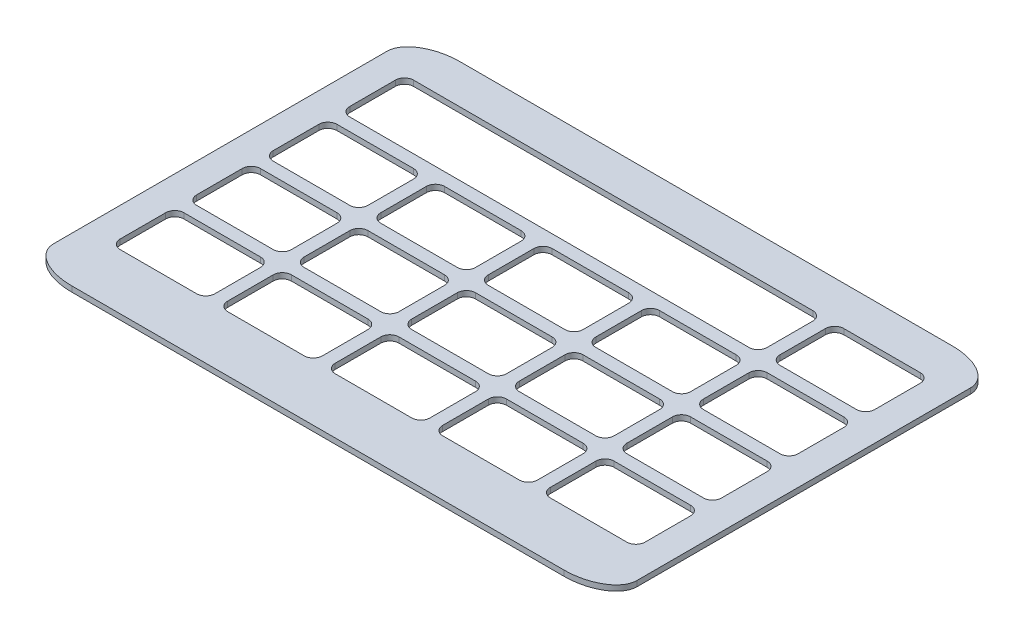
from build123d import *

# Parameters (mm, degrees)
SKETCH1_W                 = 320
SKETCH1_H                 = 213
OUTER_PROFILE_DEPTH       = 3
SKETCH5_W                 = 52
SKETCH5_H                 = 35
CUTOUT_DEPTH              = 193.227079258
CORNER_RAD_R              = 5
LPATTERN1_COUNT           = 5
LPATTERN1_PITCH           = 59
LPATTERN1_COUNT_DIR2      = 4
LPATTERN1_PITCH_DIR2      = 42
CORNER_RAD_OF_LPATTERN1_R = 5
CORNER_DEPTH              = 193.227079258
CORNERSB_COPY_1_DEPTH     = 193.227079258
SKETCH7_W                 = 135
SKETCH7_H                 = 35
CUT_EXTRUDE2_DEPTH        = 193.227079398


with BuildPart() as part:
    # Sketch1 → Outer Profile (new body)
    with BuildSketch(Plane(origin=(0, 0, 0), x_dir=(1, 0, 0), z_dir=(0, 1, 0))):
        Rectangle(SKETCH1_W, SKETCH1_H)
    extrude(amount=OUTER_PROFILE_DEPTH)

    # Sketch5 → Cutout (cut, through all)
    with BuildSketch(Plane(origin=(0, 3, 0), x_dir=(1, 0, 0), z_dir=(0, 1, 0))):
        with Locations((-118, -58.5)):
            Rectangle(SKETCH5_W, SKETCH5_H)
    cutout = extrude(amount=-CUTOUT_DEPTH, mode=Mode.SUBTRACT)

    # Corner Rad
    corner_rad_edges = [part.edges().sort_by_distance(p)[0] for p in [
        (-144, 1.5, 76),
        (-144, 1.5, 41),
        (-92, 1.5, 41),
        (-92, 1.5, 76),
    ]]
    fillet(corner_rad_edges, radius=CORNER_RAD_R)

    # LPattern1: Cutout 5 × 4
    with Locations(*[(i * LPATTERN1_PITCH, 0, -j * LPATTERN1_PITCH_DIR2) for i in range(LPATTERN1_COUNT) for j in range(LPATTERN1_COUNT_DIR2) if (i, j) != (0, 0)]):
        add(cutout, mode=Mode.SUBTRACT)

    # Corner Rad of LPattern1
    corner_rad_of_lpattern1_edges = [part.edges().sort_by_distance(p)[0] for p in [
        (-144, 1.5, 34),
        (-144, 1.5, -1),
        (-92, 1.5, -1),
        (-92, 1.5, 34),
        (-144, 1.5, -8),
        (-144, 1.5, -43),
        (-92, 1.5, -43),
        (-92, 1.5, -8),
        (-144, 1.5, -50),
        (-144, 1.5, -85),
        (-92, 1.5, -85),
        (-92, 1.5, -50),
        (-85, 1.5, 76),
        (-85, 1.5, 41),
        (-33, 1.5, 41),
        (-33, 1.5, 76),
        (-85, 1.5, 34),
        (-85, 1.5, -1),
        (-33, 1.5, -1),
        (-33, 1.5, 34),
        (-85, 1.5, -8),
        (-85, 1.5, -43),
        (-33, 1.5, -43),
        (-33, 1.5, -8),
        (-85, 1.5, -50),
        (-85, 1.5, -85),
        (-33, 1.5, -85),
        (-33, 1.5, -50),
        (-26, 1.5, 76),
        (-26, 1.5, 41),
        (26, 1.5, 41),
        (26, 1.5, 76),
        (-26, 1.5, 34),
        (-26, 1.5, -1),
        (26, 1.5, -1),
        (26, 1.5, 34),
        (-26, 1.5, -8),
        (-26, 1.5, -43),
        (26, 1.5, -43),
        (26, 1.5, -8),
        (-26, 1.5, -50),
        (-26, 1.5, -85),
        (26, 1.5, -85),
        (26, 1.5, -50),
        (33, 1.5, 76),
        (33, 1.5, 41),
        (85, 1.5, 41),
        (85, 1.5, 76),
        (33, 1.5, 34),
        (33, 1.5, -1),
        (85, 1.5, -1),
        (85, 1.5, 34),
        (33, 1.5, -8),
        (33, 1.5, -43),
        (85, 1.5, -43),
        (85, 1.5, -8),
        (33, 1.5, -50),
        (33, 1.5, -85),
        (85, 1.5, -85),
        (85, 1.5, -50),
        (92, 1.5, 76),
        (92, 1.5, 41),
        (144, 1.5, 41),
        (144, 1.5, 76),
        (92, 1.5, 34),
        (92, 1.5, -1),
        (144, 1.5, -1),
        (144, 1.5, 34),
        (92, 1.5, -8),
        (92, 1.5, -43),
        (144, 1.5, -43),
        (144, 1.5, -8),
        (92, 1.5, -50),
        (92, 1.5, -85),
        (144, 1.5, -85),
        (144, 1.5, -50),
    ]]
    fillet(corner_rad_of_lpattern1_edges, radius=CORNER_RAD_OF_LPATTERN1_R)

    # Sketch6 → Corner (cut, through all)
    with BuildSketch(Plane(origin=(0, 3, 0), x_dir=(1, 0, 0), z_dir=(0, 1, 0))):
        with BuildLine():
            Line((-135, 106.5), (-160, 106.5))
            Line((-160, 106.5), (-160, 91.5))
            add(Edge.make_bspline(
                [(-135, 106.5), (-160, 106.5), (-160, 91.5)],
                knots=[1.570796327, 1.570796327, 1.570796327, 3.141592654, 3.141592654, 3.141592654], degree=2, weights=[1, 0.707106781, 1]))
        make_face()
    corner = extrude(amount=-CORNER_DEPTH, mode=Mode.SUBTRACT)

    # CornersA: Corner across plane
    add(corner.mirror(Plane(origin=(0, 0, 0), x_dir=(0, 0, 1), z_dir=(1, 0, 0))), mode=Mode.SUBTRACT)

    # CornersB: Corner across plane
    add(corner.mirror(Plane.XY), mode=Mode.SUBTRACT)

    # CornersB copy 1 sketch → CornersB copy 1 (cut, through all)
    with BuildSketch(Plane(origin=(0, 3, 0), x_dir=(-1, 0, 0), z_dir=(0, 1, 0))):
        with BuildLine():
            Line((-135, 106.5), (-160, 106.5))
            Line((-160, 106.5), (-160, 91.5))
            add(Edge.make_bspline(
                [(-135, 106.5), (-160, 106.5), (-160, 91.5)],
                knots=[1.570796327, 1.570796327, 1.570796327, 3.141592654, 3.141592654, 3.141592654], degree=2, weights=[1, 0.707106781, 1]))
        make_face()
    extrude(amount=-CORNERSB_COPY_1_DEPTH, mode=Mode.SUBTRACT)

    # Sketch7 → Cut-Extrude2 (cut, through all)
    with BuildSketch(Plane(origin=(0, 3, 0), x_dir=(1, 0, 0), z_dir=(0, 1, 0))):
        with Locations((-29.5, 67.5)):
            Rectangle(SKETCH7_W, SKETCH7_H)
    extrude(amount=-CUT_EXTRUDE2_DEPTH, mode=Mode.SUBTRACT)


solid = part.part
